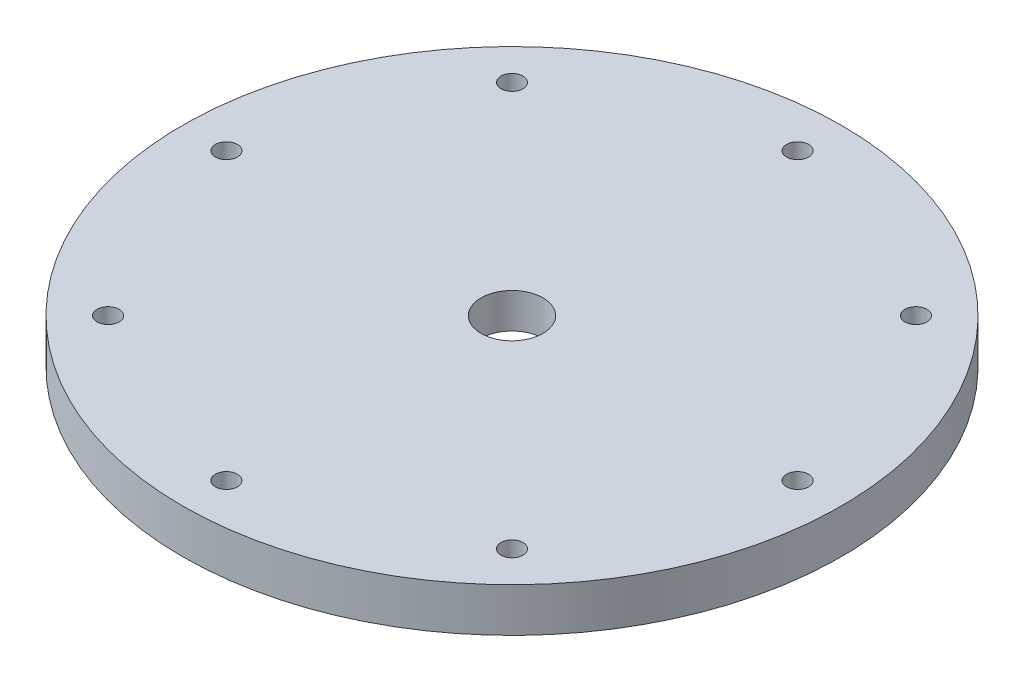
from build123d import *

# Parameters (mm, degrees)
SKETCH1_R                        = 95.25
BOSS_EXTRUDE1_DEPTH              = 12.7
F_1_4_0_25_DIAMETER_HOLE1_D      = 6.35
CIRPATTERN1_COUNT                = 8
SKETCH7_R                        = 69.9135
CUT_EXTRUDE3_DEPTH               = 2.54
SKETCH2_R                        = 68.3133
SKETCH2_R_2                      = 66.1289
CUT_EXTRUDE1_DEPTH               = 1.3208
F_45_64_0_70313_DIAMETER_HOLE1_D = 17.859502


with BuildPart() as part:
    # Sketch1 → Boss-Extrude1 (new body)
    with BuildSketch(Plane(origin=(0, 0, 0), x_dir=(1, 0, 0), z_dir=(0, 1, 0))):
        with Locations(Location((0, 0, 0), (0, 0, 270))):
            Circle(SKETCH1_R)
    extrude(amount=BOSS_EXTRUDE1_DEPTH)

    # 1/4 (0.25) Diameter Hole1 (through all)
    with Locations(Plane(origin=(0, 0, 0), x_dir=(-1, 0, 0), z_dir=(0, -1, 0))):
        with Locations((0, -82.55)):
            f_1_4_0_25_diameter_hole1 = Hole(F_1_4_0_25_DIAMETER_HOLE1_D / 2)

    # CirPattern1: 1/4 (0.25) Diameter Hole1 ×8 about axis
    cirpattern1_axis = Axis((0, 0, 0), (0, 1, 0))
    for i in range(1, CIRPATTERN1_COUNT):
        add(f_1_4_0_25_diameter_hole1.rotate(cirpattern1_axis, i * 360 / CIRPATTERN1_COUNT), mode=Mode.SUBTRACT)

    # Sketch7 → Cut-Extrude3 (cut)
    with BuildSketch(Plane(origin=(0, 0, 0), x_dir=(-1, 0, 0), z_dir=(0, -1, 0))):
        with Locations(Location((0, 0, 0), (0, 0, 90))):
            Circle(SKETCH7_R)
    extrude(amount=-CUT_EXTRUDE3_DEPTH, mode=Mode.SUBTRACT)

    # Sketch2 → Cut-Extrude1 (cut)
    with BuildSketch(Plane.XZ.offset(-2.54)):
        with Locations(Location((0, 0, 0), (0, 0, 270))):
            Circle(SKETCH2_R)
        with Locations(Location((0, 0, 0), (0, 0, 270))):
            Circle(SKETCH2_R_2, mode=Mode.SUBTRACT)
    extrude(amount=-CUT_EXTRUDE1_DEPTH, mode=Mode.SUBTRACT)

    # 45/64 (0.70313) Diameter Hole1 (through all)
    with Locations(Plane(origin=(0, 2.54, 0), x_dir=(-1, 0, 0), z_dir=(0, -1, 0))):
        with Locations((0, 0)):
            Hole(F_45_64_0_70313_DIAMETER_HOLE1_D / 2)


solid = part.part
